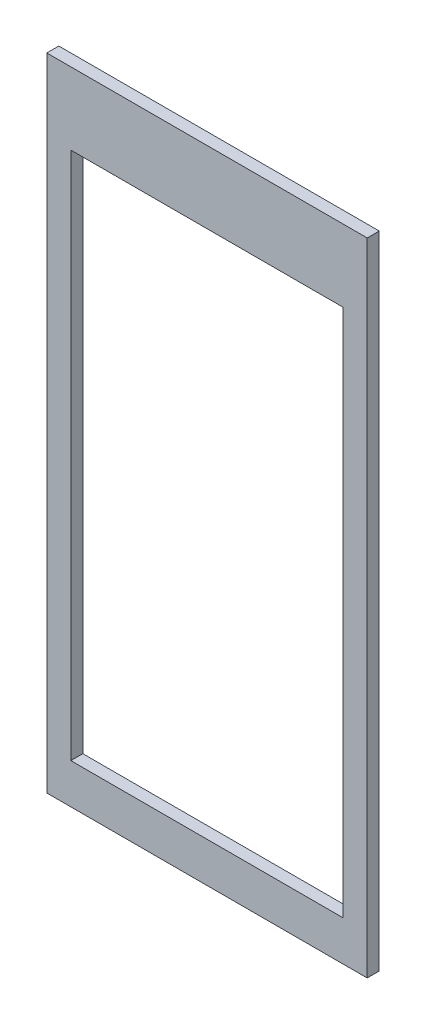
from build123d import *

# Parameters (mm, degrees)
SKETCH1_W           = 40
SKETCH1_H           = 80
BOSS_EXTRUDE1_DEPTH = 1.5
CUT_EXTRUDE1_DEPTH  = 1.5


with BuildPart() as part:
    # Sketch1 → Boss-Extrude1 (new body)
    with BuildSketch(Plane.XY):
        with Locations((20, 40)):
            Rectangle(SKETCH1_W, SKETCH1_H)
    extrude(amount=BOSS_EXTRUDE1_DEPTH)

    # Sketch2 → Cut-Extrude1 (cut)
    with BuildSketch(Plane.XY.offset(1.5)):
        Polygon((37, 71), (37, 5), (20, 5), (3, 5), (3, 71), align=None)
    extrude(amount=-CUT_EXTRUDE1_DEPTH, mode=Mode.SUBTRACT)


solid = part.part
